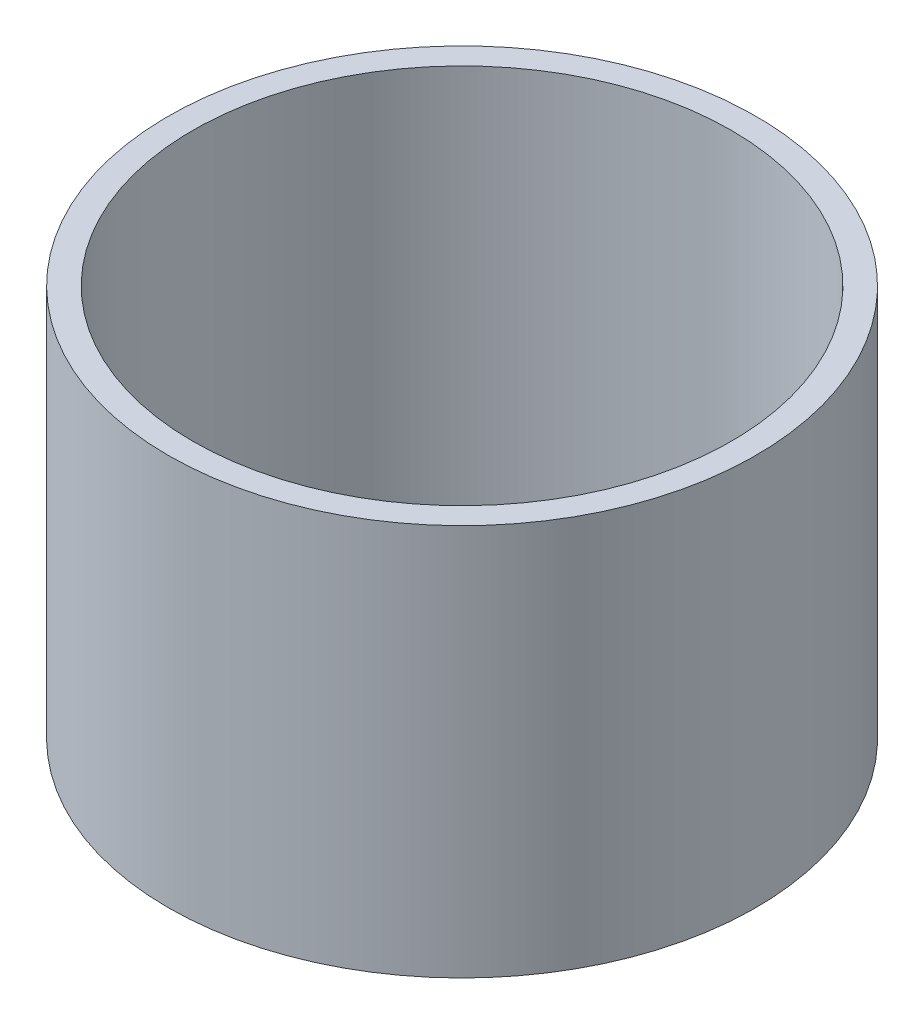
from build123d import *

# Parameters (mm, degrees)
SKETCH_1_R      = 60
SKETCH_1_R_2    = 55
EXTRUDE_1_DEPTH = 80


with BuildPart() as part:
    # 草圖1 → 填料-伸長1 (new body)
    with BuildSketch(Plane(origin=(0, 0, 0), x_dir=(1, 0, 0), z_dir=(0, 1, 0))):
        with Locations(Location((0, 0, 0), (0, 0, 270))):
            Circle(SKETCH_1_R)
        with Locations(Location((0, 0, 0), (0, 0, 270))):
            Circle(SKETCH_1_R_2, mode=Mode.SUBTRACT)
    extrude(amount=EXTRUDE_1_DEPTH)


solid = part.part
